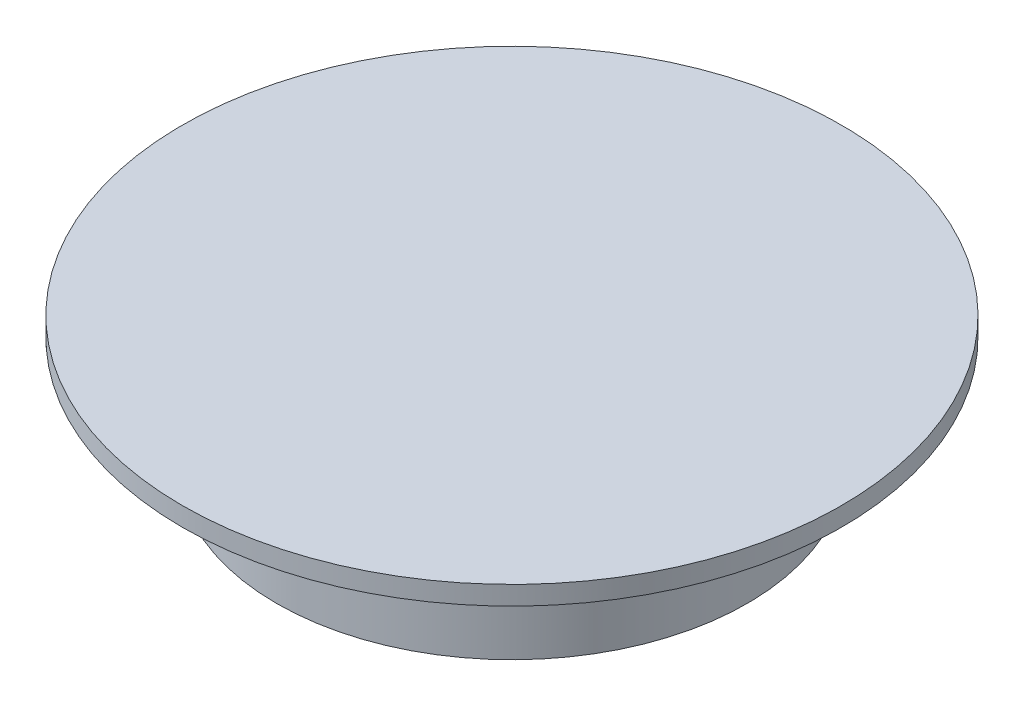
from build123d import *


with BuildPart() as part:
    # Sketch1 → Revolve1 (revolve)
    with BuildSketch(Plane(origin=(0, 0, 0), x_dir=(0, 0, -1), z_dir=(1, 0, 0))):
        Polygon((-35, 7), (-35, 5), (-25, 5), (-25, -7), (0, -7), (0, 7), align=None)
    revolve(axis=Axis((0, 5.902439024, 0), (0, -1, 0)))


solid = part.part
